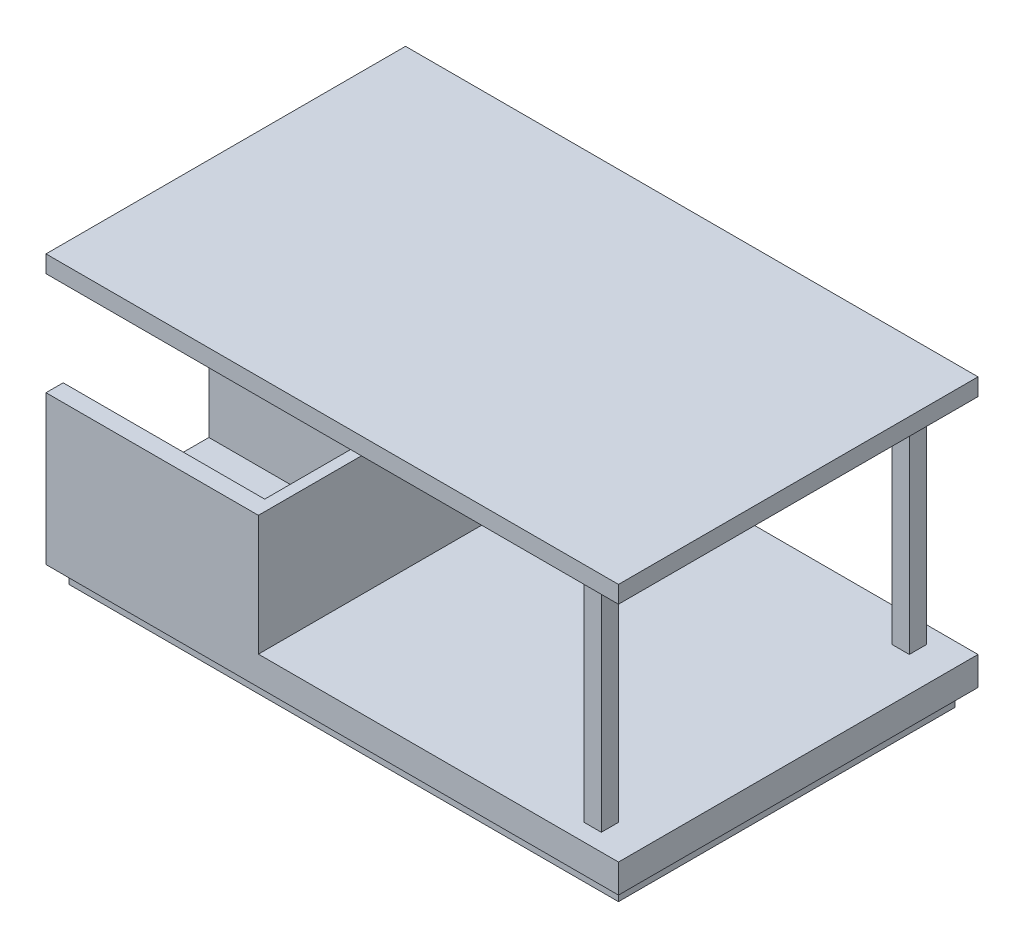
from build123d import *

# Parameters (mm, degrees)
SKETCH1_W           = 1000
SKETCH1_H           = 628
BOSS_EXTRUDE1_DEPTH = 50
SKETCH2_W           = 371
SKETCH2_H           = 628
BOSS_EXTRUDE2_DEPTH = 210
SKETCH3_W           = 569
SKETCH3_H           = 210
CUT_EXTRUDE1_DEPTH  = 352
BOSS_EXTRUDE3_DEPTH = 160
SKETCH6_W           = 628
SKETCH6_H           = 30
BOSS_EXTRUDE4_DEPTH = 1000
BOSS_EXTRUDE5_DEPTH = 242
BOSS_EXTRUDE6_START = 30
SKETCH8_W           = 790
SKETCH8_H           = 30
SKETCH8_R           = 25
BOSS_EXTRUDE6_DEPTH = 30
SKETCH9_W           = 30
SKETCH9_H           = 30
BOSS_EXTRUDE7_DEPTH = 388
SKETCH10_W          = 900
SKETCH10_H          = 30
BOSS_EXTRUDE8_DEPTH = 30


with BuildPart() as part:
    # Sketch1 → Boss-Extrude1 (new body)
    with BuildSketch(Plane(origin=(0, 0, 0), x_dir=(1, 0, 0), z_dir=(0, 1, 0))):
        Rectangle(SKETCH1_W, SKETCH1_H)
    extrude(amount=BOSS_EXTRUDE1_DEPTH)

    # Sketch2 → Boss-Extrude2 (add)
    with BuildSketch(Plane(origin=(0, 50, 0), x_dir=(1, 0, 0), z_dir=(0, 1, 0))):
        with Locations((-314.5, 0)):
            Rectangle(SKETCH2_W, SKETCH2_H)
    extrude(amount=BOSS_EXTRUDE2_DEPTH)

    # Sketch3 → Cut-Extrude1 (cut)
    with BuildSketch(Plane.ZY.offset(500)):
        with Locations((-0.5, 155)):
            Rectangle(SKETCH3_W, SKETCH3_H)
    extrude(amount=-CUT_EXTRUDE1_DEPTH, mode=Mode.SUBTRACT)

    # Sketch4 → Boss-Extrude3 (add)
    with BuildSketch(Plane(origin=(0, 50, 0), x_dir=(1, 0, 0), z_dir=(0, 1, 0))):
        Polygon((-342.55887522, -29.5), (-324, 0.5), (-342.55887522, 30.5), (-500, 30.5), (-500, -29.5), align=None)
        Polygon((-148, 30.5), (-305.44112478, 30.5), (-324, 0.5), (-305.44112478, -29.5), (-148, -29.5), align=None)
        Polygon((-305.44112478, -29.5), (-324, 0.5), (-324, -29.5), align=None)
        Polygon((-324, -29.5), (-324, 0.5), (-342.55887522, -29.5), align=None)
        Polygon((-324, 0.5), (-305.44112478, 30.5), (-324, 30.5), align=None)
        Polygon((-342.55887522, 30.5), (-324, 0.5), (-324, 30.5), align=None)
    extrude(amount=BOSS_EXTRUDE3_DEPTH)



with BuildPart() as body_2:
    # Sketch6 → Boss-Extrude4 (new body)
    with BuildSketch(Plane(origin=(500, 0, 0), x_dir=(0, 0, -1), z_dir=(1, 0, 0))):
        with Locations((0, 455)):
            Rectangle(SKETCH6_W, SKETCH6_H)
    extrude(amount=-BOSS_EXTRUDE4_DEPTH)


with BuildPart() as part_1:
    add(part.part)

    add(body_2.part)  # Boss-Extrude5 merges body 2
    # Sketch7 → Boss-Extrude5 (add)
    with BuildSketch(Plane(origin=(0, 210, 0), x_dir=(1, 0, 0), z_dir=(0, 1, 0))):
        with BuildLine():
            ThreePointArc((-392.32233047, 18.17766953), (-410, 25.5), (-427.67766953, 18.17766953))
            Line((-427.67766953, 18.17766953), (-410, 0.5))
            Line((-410, 0.5), (-392.32233047, 18.17766953))
        make_face()
        with BuildLine():
            Line((-410, 0.5), (-427.67766953, 18.17766953))
            ThreePointArc((-427.67766953, 18.17766953), (-435, 0.5), (-427.67766953, -17.17766953))
            Line((-427.67766953, -17.17766953), (-410, 0.5))
        make_face()
        with BuildLine():
            Line((-410, 0.5), (-427.67766953, -17.17766953))
            ThreePointArc((-427.67766953, -17.17766953), (-410, -24.5), (-392.32233047, -17.17766953))
            Line((-392.32233047, -17.17766953), (-410, 0.5))
        make_face()
        with BuildLine():
            ThreePointArc((-385, 0.5), (-386.903011687, 10.067085809), (-392.32233047, 18.17766953))
            Line((-392.32233047, 18.17766953), (-410, 0.5))
            Line((-410, 0.5), (-392.32233047, -17.17766953))
            ThreePointArc((-392.32233047, -17.17766953), (-386.903011687, -9.067085809), (-385, 0.5))
        make_face()
    extrude(amount=BOSS_EXTRUDE5_DEPTH)

    # Sketch8 → Boss-Extrude6 (add)
    # profile 1 of 4: a face of its own
    with BuildSketch(Plane(origin=(0, 440, 0), x_dir=(-1, 0, 0), z_dir=(0, -1, 0)).offset(BOSS_EXTRUDE6_START)):
        Polygon((-440, -284), (-410, -284), (-410, -254), (-410, 254), (-410, 284), (-440, 284), align=None)
    # profile 2 of 4: a face of its own
    with BuildSketch(Plane(origin=(0, 440, 0), x_dir=(-1, 0, 0), z_dir=(0, -1, 0)).offset(BOSS_EXTRUDE6_START)):
        Polygon((-410, -284), (440, -284), (440, -254), (380, -254), (-410, -254), align=None)
    # profile 3 of 4: a face of its own
    with BuildSketch(Plane(origin=(0, 440, 0), x_dir=(-1, 0, 0), z_dir=(0, -1, 0)).offset(BOSS_EXTRUDE6_START)):
        with Locations((-15, 269)):
            Rectangle(SKETCH8_W, SKETCH8_H)
    # profile 4 of 4: a face of its own
    with BuildSketch(Plane(origin=(0, 440, 0), x_dir=(-1, 0, 0), z_dir=(0, -1, 0)).offset(BOSS_EXTRUDE6_START)):
        Polygon((380, -254), (440, -254), (440, 284), (380, 284), (380, 254), align=None)
        with Locations(Location((410, 0.5, 0), (0, 0, 90))):
            Circle(SKETCH8_R, mode=Mode.SUBTRACT)
    extrude(amount=-BOSS_EXTRUDE6_DEPTH)

    # Sketch9 → Boss-Extrude7 (add)
    with BuildSketch(Plane(origin=(0, 410, 0), x_dir=(-1, 0, 0), z_dir=(0, -1, 0))):
        with Locations((-425, -269)):
            Rectangle(SKETCH9_W, SKETCH9_H)
        with Locations((-425, 269)):
            Rectangle(SKETCH9_W, SKETCH9_H)
    extrude(amount=BOSS_EXTRUDE7_DEPTH)

    # Sketch10 → Boss-Extrude8 (add)
    with BuildSketch(Plane(origin=(0, 0, 0), x_dir=(-1, 0, 0), z_dir=(0, -1, 0))):
        Polygon((480, -294), (480, 264), (450, 264), (450, -264), (450, -294), align=None)
        Polygon((480, 264), (480, 294), (-480, 294), (-480, 264), (-450, 264), (450, 264), align=None)
        with Locations((0, -279)):
            Rectangle(SKETCH10_W, SKETCH10_H)
        Polygon((-450, 264), (-480, 264), (-480, -294), (-450, -294), (-450, -264), align=None)
    extrude(amount=BOSS_EXTRUDE8_DEPTH)


solid = part_1.part
